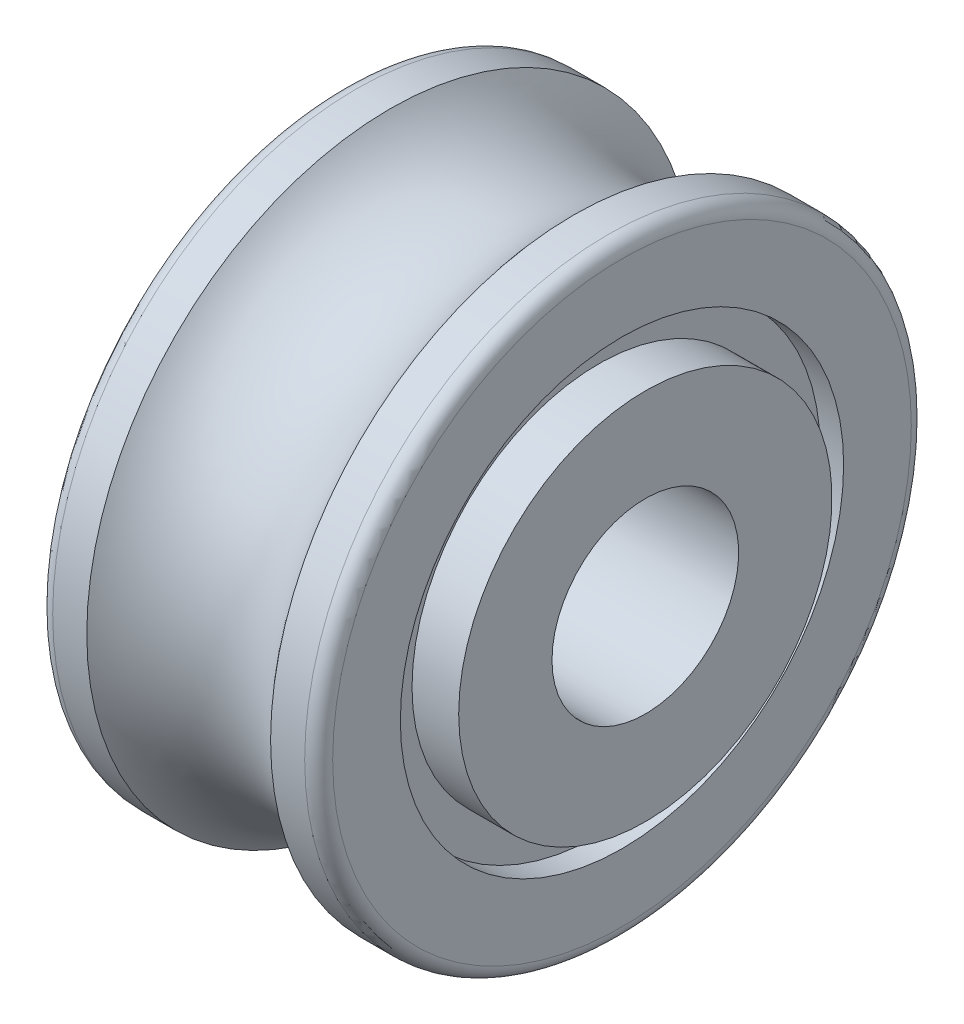
from build123d import *

# Parameters (mm, degrees)
SKETCH_2_R = 2.5
FILLET_1_R = 0.3


with BuildPart() as part:
    # 草图1 → 旋转1 (revolve)
    with BuildSketch(Plane(origin=(0, 0, 0), x_dir=(1, 0, 0), z_dir=(0, 1, 0)), mode=Mode.PRIVATE) as revolve_1_sk:
        Polygon((-3.5, 2), (3.5, 2), (3.5, 4), (2.5, 4), (2.5, 4.75), (3, 4.75), (3, 6.5), (-3, 6.5), (-3, 4.75), (-2.5, 4.75), (-2.5, 4), (-3.5, 4), align=None)
    revolve(revolve_1_sk.sketch.rotate(Axis((0, 0, 0), (1, 0, 0)), 180), axis=Axis((0, 0, 0), (1, 0, 0)))

    # 草图2 → 切除-旋转1 (revolve, cut)
    with BuildSketch(Plane(origin=(0, 0, 0), x_dir=(1, 0, 0), z_dir=(0, 1, 0)), mode=Mode.PRIVATE) as cut_revolve_1_sk:
        with Locations((0, 8.04)):
            Circle(SKETCH_2_R)
    revolve(cut_revolve_1_sk.sketch.rotate(Axis((0, 0, 0), (-1, 0, 0)), 180), axis=Axis((0, 0, 0), (-1, 0, 0)), mode=Mode.SUBTRACT)

    # 圆角1
    fillet_1_edges = [part.edges().sort_by_distance(p)[0] for p in [
        (3, 0, -6.5),
        (-3, 0, -6.5),
    ]]
    fillet(fillet_1_edges, radius=FILLET_1_R)


solid = part.part
